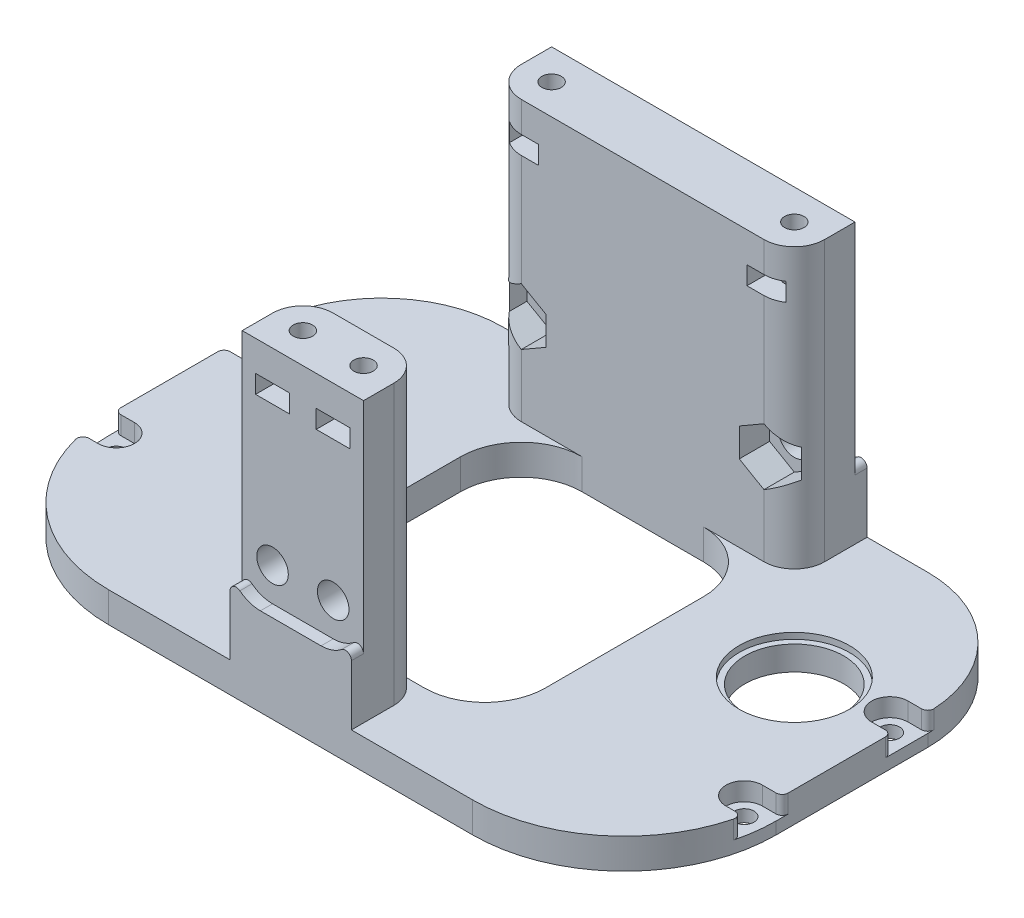
from build123d import *

# Parameters (mm, degrees)
CROQUIS1_R              = 8.15
CROQUIS1_R_2            = 1.6
SALIENTE_EXTRUIR1_DEPTH = 5
CROQUIS2_R              = 9.1
CORTAR_EXTRUIR1_DEPTH   = 1
CORTAR_EXTRUIR2_DEPTH   = 3
REDONDEO1_R             = 1
SALIENTE_EXTRUIR2_DEPTH = 46
CORTAR_EXTRUIR3_DEPTH   = 2
CORTAR_EXTRUIR4_REACH   = 103.242
CROQUIS6_R              = 2.6
CROQUIS6_W              = 5.6
CROQUIS6_H              = 3
CORTAR_EXTRUIR5_DEPTH   = 5
SALIENTE_EXTRUIR3_DEPTH = 46
CORTAR_EXTRUIR6_DEPTH   = 2
CORTAR_EXTRUIR7_REACH   = 103.242
CROQUIS10_R             = 2.6
CROQUIS10_W             = 5.6
CROQUIS10_H             = 3
CROQUIS11_R             = 1.6
CORTAR_EXTRUIR8_DEPTH   = 21
REDONDEO2_R             = 1


with BuildPart() as part:
    # Croquis1 → Saliente-Extruir1 (new body)
    with BuildSketch(Plane(origin=(0, 0, 0), x_dir=(1, 0, 0), z_dir=(0, 1, 0))):
        with BuildLine():
            Line((-30, -35), (30, -35))
            ThreePointArc((30, -35), (47.67766953, -27.67766953), (55, -10))
            Line((55, -10), (55, 15))
            ThreePointArc((55, 15), (49.142135624, 29.142135624), (35, 35))
            Line((35, 35), (-35, 35))
            ThreePointArc((-35, 35), (-49.142135624, 29.142135624), (-55, 15))
            Line((-55, 15), (-55, -10))
            ThreePointArc((-55, -10), (-47.67766953, -27.67766953), (-30, -35))
        make_face()
        with Locations(Location((39, 9, 0), (0, 0, 270))):
            Circle(CROQUIS1_R, mode=Mode.SUBTRACT)
        with Locations(Location((51.75, 12, 0), (0, 0, 270))):
            Circle(CROQUIS1_R_2, mode=Mode.SUBTRACT)
        with Locations(Location((51.75, -12, 0), (0, 0, 90))):
            Circle(CROQUIS1_R_2, mode=Mode.SUBTRACT)
        with Locations(Location((-51.75, -12, 0), (0, 0, 270))):
            Circle(CROQUIS1_R_2, mode=Mode.SUBTRACT)
        with Locations(Location((-51.75, 12, 0), (0, 0, 90))):
            Circle(CROQUIS1_R_2, mode=Mode.SUBTRACT)
        with Locations(Location((-39, 9, 0), (0, 0, 90))):
            Circle(CROQUIS1_R, mode=Mode.SUBTRACT)
        with BuildLine():
            Line((-10, -23), (10, -23))
            ThreePointArc((10, -23), (17.071067812, -20.071067812), (20, -13))
            Line((20, -13), (20, 13))
            ThreePointArc((20, 13), (17.071067812, 20.071067812), (10, 23))
            Line((10, 23), (-10, 23))
            ThreePointArc((-10, 23), (-17.071067812, 20.071067812), (-20, 13))
            Line((-20, 13), (-20, -13))
            ThreePointArc((-20, -13), (-17.071067812, -20.071067812), (-10, -23))
        make_face(mode=Mode.SUBTRACT)
    extrude(amount=SALIENTE_EXTRUIR1_DEPTH)

    # Croquis2 → Cortar-Extruir1 (cut)
    with BuildSketch(Plane(origin=(0, 5, 0), x_dir=(1, 0, 0), z_dir=(0, 1, 0))):
        with Locations(Location((39, 9, 0), (0, 0, 270))):
            Circle(CROQUIS2_R)
        with Locations(Location((-39, 9, 0), (0, 0, 90))):
            Circle(CROQUIS2_R)
    extrude(amount=-CORTAR_EXTRUIR1_DEPTH, mode=Mode.SUBTRACT)

    # Croquis3 → Cortar-Extruir2 (cut)
    with BuildSketch(Plane(origin=(0, 5, 0), x_dir=(1, 0, 0), z_dir=(0, 1, 0))):
        with BuildLine():
            Line((51.75, 15), (55, 15))
            Line((55, 15), (55, 9))
            Line((55, 9), (51.75, 9))
            ThreePointArc((51.75, 9), (48.75, 12), (51.75, 15))
        make_face()
        with BuildLine():
            Line((51.75, -15), (55, -15))
            Line((55, -15), (55, -9))
            Line((55, -9), (51.75, -9))
            ThreePointArc((51.75, -9), (48.75, -12), (51.75, -15))
        make_face()
        with BuildLine():
            Line((-51.75, -9), (-55, -9))
            Line((-55, -9), (-55, -15))
            Line((-55, -15), (-51.75, -15))
            ThreePointArc((-51.75, -15), (-48.75, -12), (-51.75, -9))
        make_face()
        with BuildLine():
            Line((-51.75, 15), (-55, 15))
            Line((-55, 15), (-55, 9))
            Line((-55, 9), (-51.75, 9))
            ThreePointArc((-51.75, 9), (-48.75, 12), (-51.75, 15))
        make_face()
    extrude(amount=-CORTAR_EXTRUIR2_DEPTH, mode=Mode.SUBTRACT)

    # Redondeo1
    redondeo1_edges = [part.edges().sort_by_distance(p)[0] for p in [
        (-55, 3.5, -9),
        (-55, 3.5, 9),
        (55, 3.5, 9),
        (55, 3.5, -9),
        (55, 3.5, -15),
        (-55, 3.5, -15),
        (54.494897428, 3.5, 15),
        (-54.494897428, 3.5, 15),
    ]]
    fillet(redondeo1_edges, radius=REDONDEO1_R)

    # Croquis4 → Saliente-Extruir2 (add)
    with BuildSketch(Plane(origin=(0, 5, 0), x_dir=(1, 0, 0), z_dir=(0, 1, 0))):
        with BuildLine():
            Line((-25, 35), (25, 35))
            Line((25, 35), (25, 28))
            ThreePointArc((25, 28), (23.535533906, 24.464466094), (20, 23))
            Line((20, 23), (-20, 23))
            ThreePointArc((-20, 23), (-23.535533906, 24.464466094), (-25, 28))
            Line((-25, 28), (-25, 35))
        make_face()
    extrude(amount=SALIENTE_EXTRUIR2_DEPTH)

    # Croquis5 → Cortar-Extruir3 (cut)
    with BuildSketch(Plane(origin=(0, 0, -35), x_dir=(-1, 0, 0), z_dir=(0, 0, -1))):
        with BuildLine():
            Line((-25, 51), (25, 51))
            Line((25, 51), (25, 17.708712153))
            ThreePointArc((25, 17.708712153), (22.970514841, 15.371172764), (20, 14.5))
            Line((20, 14.5), (-20, 14.5))
            ThreePointArc((-20, 14.5), (-22.970514841, 15.371172764), (-25, 17.708712153))
            Line((-25, 17.708712153), (-25, 51))
        make_face()
    extrude(amount=-CORTAR_EXTRUIR3_DEPTH, mode=Mode.SUBTRACT)

    # Cortar-Extruir4: up to this face of the body (flat: up to its plane)
    cortar_extruir4_end = Plane(part.part.faces().sort_by_distance((0, 26.68556701, -23))[0])
    # Croquis6 → Cortar-Extruir4 (cut, up to the picked face)
    with BuildSketch(Plane(origin=(0, 0, -33), x_dir=(-1, 0, 0), z_dir=(0, 0, -1)), mode=Mode.PRIVATE) as cortar_extruir4_sk1:
        with Locations((-20, 20)):
            Circle(CROQUIS6_R)
    cortar_extruir4_tool1 = split(extrude(cortar_extruir4_sk1.sketch, amount=-CORTAR_EXTRUIR4_REACH, mode=Mode.PRIVATE), bisect_by=cortar_extruir4_end, keep=Keep.BOTH, mode=Mode.PRIVATE)
    # Croquis6 → Cortar-Extruir4 (cut, up to the picked face)
    with BuildSketch(Plane(origin=(0, 0, -33), x_dir=(-1, 0, 0), z_dir=(0, 0, -1)), mode=Mode.PRIVATE) as cortar_extruir4_sk2:
        with Locations(Location((20, 20, 0), (0, 0, 90))):
            Circle(CROQUIS6_R)
    cortar_extruir4_tool2 = split(extrude(cortar_extruir4_sk2.sketch, amount=-CORTAR_EXTRUIR4_REACH, mode=Mode.PRIVATE), bisect_by=cortar_extruir4_end, keep=Keep.BOTH, mode=Mode.PRIVATE)
    # Croquis6 → Cortar-Extruir4 (cut, up to the picked face)
    with BuildSketch(Plane(origin=(0, 0, -33), x_dir=(-1, 0, 0), z_dir=(0, 0, -1)), mode=Mode.PRIVATE) as cortar_extruir4_sk3:
        with Locations((-20, 44.5)):
            Rectangle(CROQUIS6_W, CROQUIS6_H)
    cortar_extruir4_tool3 = split(extrude(cortar_extruir4_sk3.sketch, amount=-CORTAR_EXTRUIR4_REACH, mode=Mode.PRIVATE), bisect_by=cortar_extruir4_end, keep=Keep.BOTH, mode=Mode.PRIVATE)
    # Croquis6 → Cortar-Extruir4 (cut, up to the picked face)
    with BuildSketch(Plane(origin=(0, 0, -33), x_dir=(-1, 0, 0), z_dir=(0, 0, -1)), mode=Mode.PRIVATE) as cortar_extruir4_sk4:
        with Locations((20, 44.5)):
            Rectangle(CROQUIS6_W, CROQUIS6_H)
    cortar_extruir4_tool4 = split(extrude(cortar_extruir4_sk4.sketch, amount=-CORTAR_EXTRUIR4_REACH, mode=Mode.PRIVATE), bisect_by=cortar_extruir4_end, keep=Keep.BOTH, mode=Mode.PRIVATE)
    add(cortar_extruir4_tool1.solids().sort_by(Axis((20, 20, -33), (0, 0, 1)))[0], mode=Mode.SUBTRACT)
    add(cortar_extruir4_tool2.solids().sort_by(Axis((-20, 20, -33), (0, 0, 1)))[0], mode=Mode.SUBTRACT)
    add(cortar_extruir4_tool3.solids().sort_by(Axis((20, 44.5, -33), (0, 0, 1)))[0], mode=Mode.SUBTRACT)
    add(cortar_extruir4_tool4.solids().sort_by(Axis((-20, 44.5, -33), (0, 0, 1)))[0], mode=Mode.SUBTRACT)

    # Croquis7 → Cortar-Extruir5 (cut)
    with BuildSketch(Plane.XY.offset(-23)):
        Polygon((-20, 24.7), (-24.070319398, 22.35), (-24.070319398, 17.65), (-20, 15.3), (-15.929680602, 17.65), (-15.929680602, 22.35), align=None)
        Polygon((15.929680602, 22.35), (20, 24.7), (24.070319398, 22.35), (24.070319398, 17.65), (20, 15.3), (15.929680602, 17.65), align=None)
    extrude(amount=-CORTAR_EXTRUIR5_DEPTH, mode=Mode.SUBTRACT)

    # Croquis8 → Saliente-Extruir3 (add)
    with BuildSketch(Plane(origin=(0, 5, 0), x_dir=(1, 0, 0), z_dir=(0, 1, 0))):
        with BuildLine():
            Line((-10, -35), (10, -35))
            Line((10, -35), (10, -28))
            ThreePointArc((10, -28), (8.535533906, -24.464466094), (5, -23))
            Line((5, -23), (-5, -23))
            ThreePointArc((-5, -23), (-8.535533906, -24.464466094), (-10, -28))
            Line((-10, -28), (-10, -35))
        make_face()
    extrude(amount=SALIENTE_EXTRUIR3_DEPTH)

    # Croquis9 → Cortar-Extruir6 (cut)
    with BuildSketch(Plane.XY.offset(35)):
        with BuildLine():
            Line((10, 17.708712153), (10, 51))
            Line((10, 51), (-10, 51))
            Line((-10, 51), (-10, 17.708712153))
            ThreePointArc((-10, 17.708712153), (-7.970514841, 15.371172764), (-5, 14.5))
            Line((-5, 14.5), (5, 14.5))
            ThreePointArc((5, 14.5), (7.970514841, 15.371172764), (10, 17.708712153))
        make_face()
    extrude(amount=-CORTAR_EXTRUIR6_DEPTH, mode=Mode.SUBTRACT)

    # Cortar-Extruir7: up to this face of the body (flat: up to its plane)
    cortar_extruir7_end = Plane(part.part.faces().sort_by_distance((0, 23.446428571, 23))[0])
    # Croquis10 → Cortar-Extruir7 (cut, up to the picked face)
    with BuildSketch(Plane.XY.offset(33), mode=Mode.PRIVATE) as cortar_extruir7_sk1:
        with Locations((-5, 20)):
            Circle(CROQUIS10_R)
    cortar_extruir7_tool1 = split(extrude(cortar_extruir7_sk1.sketch, amount=-CORTAR_EXTRUIR7_REACH, mode=Mode.PRIVATE), bisect_by=cortar_extruir7_end, keep=Keep.BOTH, mode=Mode.PRIVATE)
    # Croquis10 → Cortar-Extruir7 (cut, up to the picked face)
    with BuildSketch(Plane.XY.offset(33), mode=Mode.PRIVATE) as cortar_extruir7_sk2:
        with Locations(Location((5, 20, 0), (0, 0, 90))):
            Circle(CROQUIS10_R)
    cortar_extruir7_tool2 = split(extrude(cortar_extruir7_sk2.sketch, amount=-CORTAR_EXTRUIR7_REACH, mode=Mode.PRIVATE), bisect_by=cortar_extruir7_end, keep=Keep.BOTH, mode=Mode.PRIVATE)
    # Croquis10 → Cortar-Extruir7 (cut, up to the picked face)
    with BuildSketch(Plane.XY.offset(33), mode=Mode.PRIVATE) as cortar_extruir7_sk3:
        with Locations((-5, 44.5)):
            Rectangle(CROQUIS10_W, CROQUIS10_H)
    cortar_extruir7_tool3 = split(extrude(cortar_extruir7_sk3.sketch, amount=-CORTAR_EXTRUIR7_REACH, mode=Mode.PRIVATE), bisect_by=cortar_extruir7_end, keep=Keep.BOTH, mode=Mode.PRIVATE)
    # Croquis10 → Cortar-Extruir7 (cut, up to the picked face)
    with BuildSketch(Plane.XY.offset(33), mode=Mode.PRIVATE) as cortar_extruir7_sk4:
        with Locations((5, 44.5)):
            Rectangle(CROQUIS10_W, CROQUIS10_H)
    cortar_extruir7_tool4 = split(extrude(cortar_extruir7_sk4.sketch, amount=-CORTAR_EXTRUIR7_REACH, mode=Mode.PRIVATE), bisect_by=cortar_extruir7_end, keep=Keep.BOTH, mode=Mode.PRIVATE)
    add(cortar_extruir7_tool1.solids().sort_by(Axis((-5, 20, 33), (0, 0, -1)))[0], mode=Mode.SUBTRACT)
    add(cortar_extruir7_tool2.solids().sort_by(Axis((5, 20, 33), (0, 0, -1)))[0], mode=Mode.SUBTRACT)
    add(cortar_extruir7_tool3.solids().sort_by(Axis((-5, 44.5, 33), (0, 0, -1)))[0], mode=Mode.SUBTRACT)
    add(cortar_extruir7_tool4.solids().sort_by(Axis((5, 44.5, 33), (0, 0, -1)))[0], mode=Mode.SUBTRACT)

    # Croquis11 → Cortar-Extruir8 (cut)
    with BuildSketch(Plane(origin=(0, 51, 0), x_dir=(1, 0, 0), z_dir=(0, 1, 0))):
        with Locations(Location((-5, -28, 0), (0, 0, 270))):
            Circle(CROQUIS11_R)
        with Locations(Location((-20, 28, 0), (0, 0, 270))):
            Circle(CROQUIS11_R)
        with Locations(Location((5, -28, 0), (0, 0, 270))):
            Circle(CROQUIS11_R)
        with Locations(Location((20, 28, 0), (0, 0, 270))):
            Circle(CROQUIS11_R)
    extrude(amount=-CORTAR_EXTRUIR8_DEPTH, mode=Mode.SUBTRACT)

    # Redondeo2
    redondeo2_edges = [part.edges().sort_by_distance(p)[0] for p in [
        (25, 17.708712153, -34),
        (-25, 17.708712153, -34),
        (10, 17.708712153, 34),
        (-10, 17.708712153, 34),
    ]]
    fillet(redondeo2_edges, radius=REDONDEO2_R)


solid = part.part
